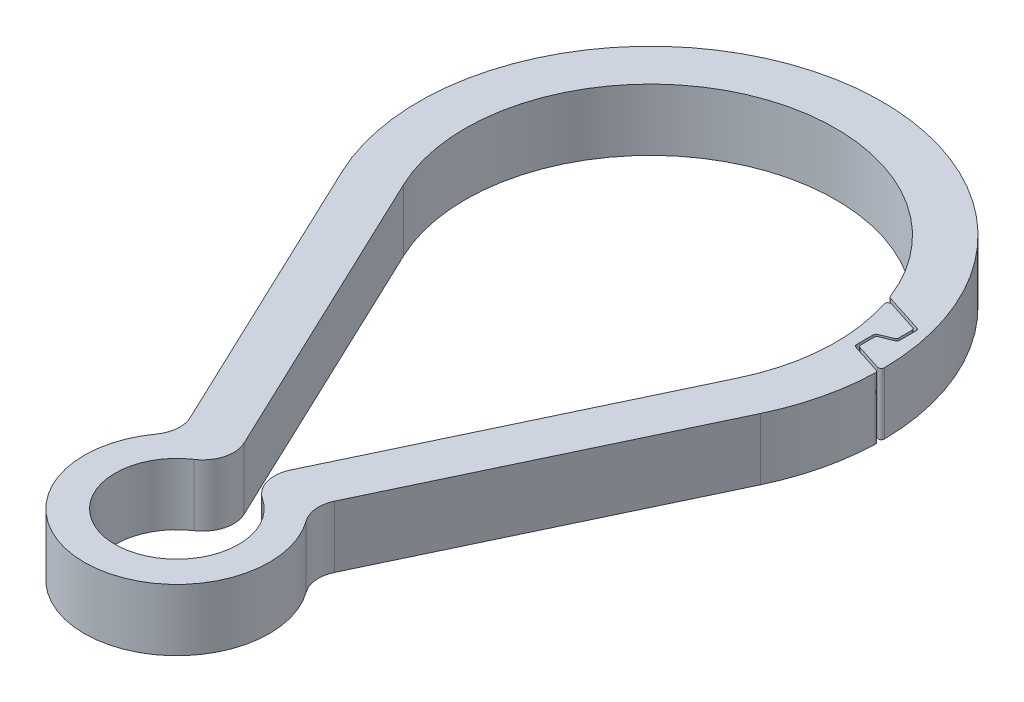
from build123d import *

# Parameters (mm, degrees)
BOSS_EXTRUDE1_DEPTH = 10
FILLET1_R           = 5
CUT_EXTRUDE1_DEPTH  = 121.593129692
FILLET2_R           = 0.5


with BuildPart() as part:
    # Sketch1 → Boss-Extrude1 (new body)
    with BuildSketch(Plane(origin=(0, 0, 0), x_dir=(1, 0, 0), z_dir=(0, 1, 0))):
        with BuildLine():
            Line((10.30016758, 10.9044279), (33.8799835, 60.602564318))
            ThreePointArc((33.8799835, 60.602564318), (0, 114.177287273), (-33.8799835, 60.602564318))
            Line((-33.8799835, 60.602564318), (-10.30016758, 10.9044279))
            ThreePointArc((-10.30016758, 10.9044279), (0, -15), (10.30016758, 10.9044279))
        make_face()
        with BuildLine():
            Line((27.1039868, 63.817508909), (1.514929585, 9.884583368))
            ThreePointArc((1.514929585, 9.884583368), (0, -10), (-1.514929585, 9.884583368))
            Line((-1.514929585, 9.884583368), (-27.1039868, 63.817508909))
            ThreePointArc((-27.1039868, 63.817508909), (0, 106.677287273), (27.1039868, 63.817508909))
        make_face(mode=Mode.SUBTRACT)
    extrude(amount=BOSS_EXTRUDE1_DEPTH)

    # Fillet1
    fillet1_edges = [part.edges().sort_by_distance(p)[0] for p in [
        (10.30016758, 5, -10.9044279),
        (-10.30016758, 5, -10.9044279),
        (1.514929585, 5, -9.884583368),
        (-1.514929585, 5, -9.884583368),
    ]]
    fillet(fillet1_edges, radius=FILLET1_R)

    # Sketch2 → Cut-Extrude1 (cut, through all)
    with BuildSketch(Plane(origin=(0, 10, 0), x_dir=(1, 0, 0), z_dir=(0, 1, 0))):
        with BuildLine():
            Line((21.877604248, 88.906739184), (34.135902296, 84.971177619))
            ThreePointArc((34.135902296, 84.971177619), (34.387053168, 84.789711637), (34.483059832, 84.495111257))
            Line((34.483059832, 84.495111257), (34.483059832, 82.414608392))
            ThreePointArc((34.483059832, 82.414608392), (34.398003238, 82.135642498), (34.171771953, 81.95158816))
            Line((34.171771953, 81.95158816), (32.294347711, 81.186410559))
            ThreePointArc((32.294347711, 81.186410559), (32.068116426, 81.00235622), (31.983059832, 80.723390327))
            Line((31.983059832, 80.723390327), (31.983059832, 78.082279644))
            ThreePointArc((31.983059832, 78.082279644), (32.079066495, 77.787679264), (32.330217368, 77.606213282))
            Line((32.330217368, 77.606213282), (46.132813135, 73.174850528))
            Line((46.132813135, 73.174850528), (46.255087106, 73.555703617))
            Line((46.255087106, 73.555703617), (32.730217368, 77.897901638))
            ThreePointArc((32.730217368, 77.897901638), (32.479066495, 78.07936762), (32.383059832, 78.373968))
            Line((32.383059832, 78.373968), (32.383059832, 80.454470865))
            ThreePointArc((32.383059832, 80.454470865), (32.468116426, 80.733436759), (32.694347711, 80.917491097))
            Line((32.694347711, 80.917491097), (34.571771953, 81.682668698))
            ThreePointArc((34.571771953, 81.682668698), (34.798003238, 81.866723036), (34.883059832, 82.14568893))
            Line((34.883059832, 82.14568893), (34.883059832, 84.786799612))
            ThreePointArc((34.883059832, 84.786799612), (34.787053168, 85.081399993), (34.535902296, 85.262865975))
            Line((34.535902296, 85.262865975), (21.999878219, 89.287592274))
            Line((21.999878219, 89.287592274), (21.877604248, 88.906739184))
        make_face()
    extrude(amount=-CUT_EXTRUDE1_DEPTH, mode=Mode.SUBTRACT)

    # Fillet2
    fillet2_edges = [part.edges().sort_by_distance(p)[0] for p in [
        (28.037681738, 5, -87.349138226),
        (37.498715951, 5, -76.366961562),
        (37.492921713, 5, -75.948712321),
        (28.214590334, 5, -86.87223172),
    ]]
    fillet(fillet2_edges, radius=FILLET2_R)


solid = part.part
